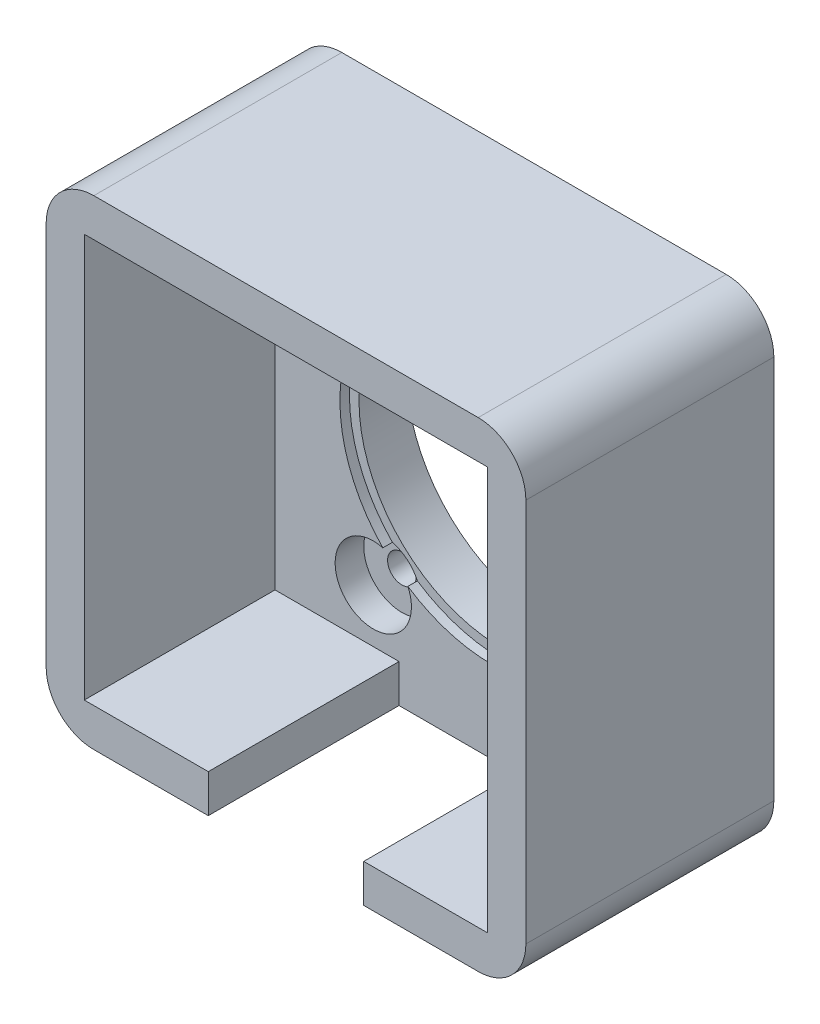
from build123d import *

# Parameters (mm, degrees)
ESQUISSE1_W             = 50.3
ESQUISSE1_H             = 50.3
BOSS_EXTRU_1_DEPTH      = 6
BOSS_EXTRU_2_DEPTH      = 20
ESQUISSE3_R             = 1.5
ENL_V_MAT_EXTRU_1_DEPTH = 76.737573238
CONG_2_R                = 5
ESQUISSE4_R             = 4
ENL_V_MAT_EXTRU_2_DEPTH = 3
CONG_6_R                = 5
ESQUISSE5_R             = 16
ENL_V_MAT_EXTRU_3_DEPTH = 1
ESQUISSE6_R             = 15
ENL_V_MAT_EXTRU_4_DEPTH = 21


with BuildPart() as part:
    # Esquisse1 → Boss.-Extru.1 (new body)
    with BuildSketch(Plane.XY):
        with Locations((25.15, 25.15)):
            Rectangle(ESQUISSE1_W, ESQUISSE1_H)
    extrude(amount=BOSS_EXTRU_1_DEPTH)

    # Esquisse2 → Boss.-Extru.2 (add)
    with BuildSketch(Plane.XY.offset(6)):
        Polygon((4, 46.3), (46.3, 46.3), (46.3, 4), (33.3, 4), (33.3, 0), (50.3, 0), (50.3, 50.3), (0, 50.3), (0, 0), (17, 0), (17, 4), (4, 4), align=None)
    extrude(amount=BOSS_EXTRU_2_DEPTH)

    # Esquisse3 → Enlèv. mat.-Extru.1 (cut, through all)
    with BuildSketch(Plane(origin=(0, 0, 0), x_dir=(-1, 0, 0), z_dir=(0, 0, -1))):
        with Locations((-39.3, 39.6)):
            Circle(ESQUISSE3_R)
        with Locations((-14.3, 39.6)):
            Circle(ESQUISSE3_R)
        with Locations((-14.3, 9.6)):
            Circle(ESQUISSE3_R)
        with Locations((-39.3, 9.6)):
            Circle(ESQUISSE3_R)
    extrude(amount=-ENL_V_MAT_EXTRU_1_DEPTH, mode=Mode.SUBTRACT)

    # Congé2
    cong_2_edges = [part.edges().sort_by_distance(p)[0] for p in [
        (0, 50.3, 13),
    ]]
    fillet(cong_2_edges, radius=CONG_2_R)

    # Esquisse4 → Enlèv. mat.-Extru.2 (cut)
    with BuildSketch(Plane.XY.offset(6)):
        with Locations((14.3, 39.6)):
            Circle(ESQUISSE4_R)
        with Locations((39.3, 39.6)):
            Circle(ESQUISSE4_R)
        with Locations((39.3, 9.6)):
            Circle(ESQUISSE4_R)
        with Locations((14.3, 9.6)):
            Circle(ESQUISSE4_R)
    extrude(amount=-ENL_V_MAT_EXTRU_2_DEPTH, mode=Mode.SUBTRACT)

    # Congé6
    cong_6_edges = [part.edges().sort_by_distance(p)[0] for p in [
        (50.3, 50.3, 13),
        (50.3, 0, 13),
        (0, 0, 13),
    ]]
    fillet(cong_6_edges, radius=CONG_6_R)

    # Esquisse5 → Enlèv. mat.-Extru.3 (cut)
    with BuildSketch(Plane.XY.offset(6)):
        with Locations((26.8, 24.6)):
            Circle(ESQUISSE5_R)
    extrude(amount=-ENL_V_MAT_EXTRU_3_DEPTH, mode=Mode.SUBTRACT)

    # Esquisse6 → Enlèv. mat.-Extru.4 (cut)
    with BuildSketch(Plane.XY.offset(5)):
        with Locations((26.8, 24.6)):
            Circle(ESQUISSE6_R)
    extrude(amount=-ENL_V_MAT_EXTRU_4_DEPTH, mode=Mode.SUBTRACT)


solid = part.part
